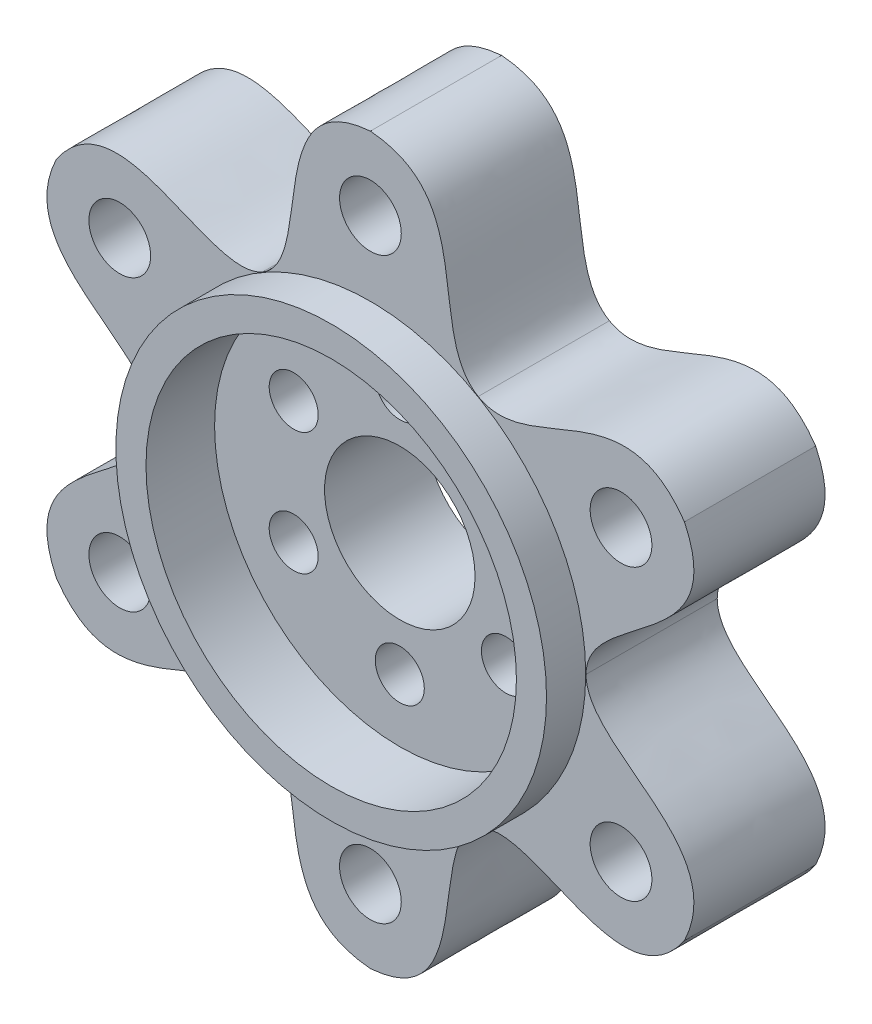
from build123d import *

# Parameters (mm, degrees)
SKETCH1_R                = 46.99
SKETCH1_R_2              = 3.175
SKETCH1_R_3              = 9.75
SKETCH1_R_4              = 4
BOSS_EXTRUDE1_DEPTH      = 17
CUT_EXTRUDE2_DEPTH       = 69.593878736
BOSS_EXTRUDE2_DEPTH      = 5.08
BOSS_EXTRUDE2_DEPTH_BACK = 17
SKETCH7_R                = 27.9
SKETCH7_R_2              = 24
CUT_EXTRUDE3_START       = -3.81
SKETCH8_R                = 24
CUT_EXTRUDE3_DEPTH       = 3.81


with BuildPart() as part:
    # Sketch1 → Boss-Extrude1 (new body)
    with BuildSketch(Plane.XY):
        Circle(SKETCH1_R)
        with Locations((0, 15.875)):
            Circle(SKETCH1_R_2, mode=Mode.SUBTRACT)
        Circle(SKETCH1_R_3, mode=Mode.SUBTRACT)
        with Locations((0, 37.500000057)):
            Circle(SKETCH1_R_4, mode=Mode.SUBTRACT)
        with Locations((-32.475952658, 18.750000086)):
            Circle(SKETCH1_R_4, mode=Mode.SUBTRACT)
        with Locations((-32.475952757, -18.749999915)):
            Circle(SKETCH1_R_4, mode=Mode.SUBTRACT)
        with Locations((32.475952658, 18.750000086)):
            Circle(SKETCH1_R_4, mode=Mode.SUBTRACT)
        with Locations((32.475952362, -18.749999914)):
            Circle(SKETCH1_R_4, mode=Mode.SUBTRACT)
        with Locations((-1.97e-07, -37.500000057)):
            Circle(SKETCH1_R_4, mode=Mode.SUBTRACT)
        with Locations((13.748153285, 7.9375)):
            Circle(SKETCH1_R_2, mode=Mode.SUBTRACT)
        with Locations((13.748153285, -7.9375)):
            Circle(SKETCH1_R_2, mode=Mode.SUBTRACT)
        with Locations((0, -15.875)):
            Circle(SKETCH1_R_2, mode=Mode.SUBTRACT)
        with Locations((-13.748153285, -7.9375)):
            Circle(SKETCH1_R_2, mode=Mode.SUBTRACT)
        with Locations((-13.748153285, 7.9375)):
            Circle(SKETCH1_R_2, mode=Mode.SUBTRACT)
    extrude(amount=BOSS_EXTRUDE1_DEPTH)

    # Sketch3 → Cut-Extrude2 (cut, through all)
    with BuildSketch(Plane.XY.offset(17)):
        with BuildLine():
            add(Edge.make_bspline(
                [(0, 46.99), (-14.204157194, 45.847251077), (-7.045904013, 28.257565433), (-13.97, 24.196749782)],
                knots=[0, 0, 0, 0, 1, 1, 1, 1], degree=3))
            ThreePointArc((0, 46.99), (-23.495, 40.694533724), (-40.694533724, 23.495))
            add(Edge.make_bspline(
                [(-40.694533724, 23.495), (-32.602805529, 35.224786508), (-20.948817508, 20.230714585), (-13.97, 24.196749782)],
                knots=[0, 0, 0, 0, 1, 1, 1, 1], degree=3))
        make_face()
        with BuildLine():
            ThreePointArc((40.694533724, 23.495), (23.495, 40.694533724), (0, 46.99))
            add(Edge.make_bspline(
                [(0, 46.99), (14.204157194, 45.847251077), (7.045904013, 28.257565433), (13.97, 24.196749782)],
                knots=[0, 0, 0, 0, 1, 1, 1, 1], degree=3))
            add(Edge.make_bspline(
                [(40.694533724, 23.495), (32.602805529, 35.224786508), (20.948817508, 20.230714585), (13.97, 24.196749782)],
                knots=[0, 0, 0, 0, 1, 1, 1, 1], degree=3))
        make_face()
        with BuildLine():
            ThreePointArc((46.99, 0), (45.388854577, 12.161906929), (40.694533724, 23.495))
            add(Edge.make_bspline(
                [(40.694533724, 23.495), (46.806962724, 10.622464569), (27.994721521, 8.026850849), (27.94, 0)],
                knots=[0, 0, 0, 0, 1, 1, 1, 1], degree=3))
            add(Edge.make_bspline(
                [(40.694533724, -23.495), (46.806962724, -10.622464569), (27.994721521, -8.026850849), (27.94, 0)],
                knots=[0, 0, 0, 0, 1, 1, 1, 1], degree=3))
            ThreePointArc((40.694533724, -23.495), (45.388854577, -12.161906929), (46.99, 0))
        make_face()
        with BuildLine():
            ThreePointArc((0, -46.99), (23.495, -40.694533724), (40.694533724, -23.495))
            add(Edge.make_bspline(
                [(40.694533724, -23.495), (32.602805529, -35.224786508), (20.948817508, -20.230714585), (13.97, -24.196749782)],
                knots=[0, 0, 0, 0, 1, 1, 1, 1], degree=3))
            add(Edge.make_bspline(
                [(0, -46.99), (14.204157194, -45.847251077), (7.045904013, -28.257565433), (13.97, -24.196749782)],
                knots=[0, 0, 0, 0, 1, 1, 1, 1], degree=3))
        make_face()
        with BuildLine():
            add(Edge.make_bspline(
                [(-40.694533724, -23.495), (-32.602805529, -35.224786508), (-20.948817508, -20.230714585), (-13.97, -24.196749782)],
                knots=[0, 0, 0, 0, 1, 1, 1, 1], degree=3))
            ThreePointArc((-40.694533724, -23.495), (-23.495, -40.694533724), (0, -46.99))
            add(Edge.make_bspline(
                [(0, -46.99), (-14.204157194, -45.847251077), (-7.045904013, -28.257565433), (-13.97, -24.196749782)],
                knots=[0, 0, 0, 0, 1, 1, 1, 1], degree=3))
        make_face()
        with BuildLine():
            add(Edge.make_bspline(
                [(-40.694533724, 23.495), (-46.806962724, 10.622464569), (-27.994721521, 8.026850849), (-27.94, 0)],
                knots=[0, 0, 0, 0, 1, 1, 1, 1], degree=3))
            ThreePointArc((-40.694533724, 23.495), (-46.99, 0), (-40.694533724, -23.495))
            add(Edge.make_bspline(
                [(-40.694533724, -23.495), (-46.806962724, -10.622464569), (-27.994721521, -8.026850849), (-27.94, 0)],
                knots=[0, 0, 0, 0, 1, 1, 1, 1], degree=3))
        make_face()
    extrude(amount=-CUT_EXTRUDE2_DEPTH, mode=Mode.SUBTRACT)

    # Sketch7 → Boss-Extrude2 (add, two sides: drawn at the far end of the back side and taken through both)
    with BuildSketch(Plane.XY.offset(17).offset(-BOSS_EXTRUDE2_DEPTH_BACK)):
        Circle(SKETCH7_R)
        Circle(SKETCH7_R_2, mode=Mode.SUBTRACT)
    extrude(amount=BOSS_EXTRUDE2_DEPTH + BOSS_EXTRUDE2_DEPTH_BACK)

    # Sketch8 → Cut-Extrude3 (cut)
    with BuildSketch(Plane.XY.offset(17).offset(CUT_EXTRUDE3_START)):
        Circle(SKETCH8_R)
    extrude(amount=CUT_EXTRUDE3_DEPTH, mode=Mode.SUBTRACT)


solid = part.part
